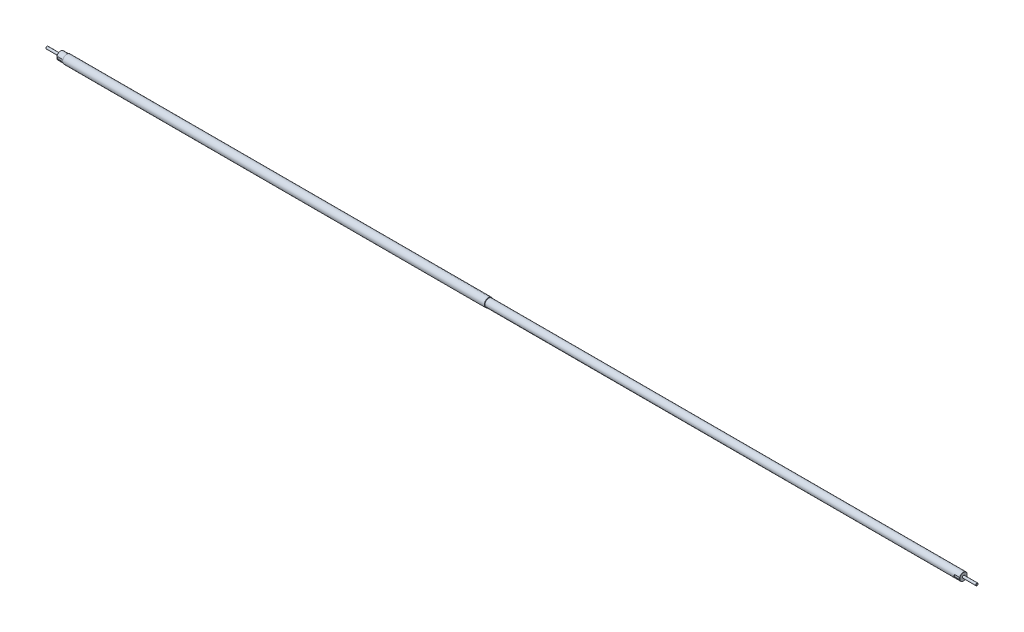
from build123d import *

# Parameters (mm, degrees)
CHAMFER_1_SIZE      = 0.5
CUT_EXTRUDE_1_DEPTH = 1.2
SKETCH_5_R          = 4
CUT_EXTRUDE_2_DEPTH = 5
CUT_EXTRUDE_3_DEPTH = 1.2


with BuildPart() as part:
    # Эскиз1 → Повернуть1 (revolve)
    with BuildSketch(Plane.XY):
        with BuildLine():
            Line((0, 2.5), (0, 0))
            Line((0, 0), (721.167070453, 0))
            Line((721.167070453, 0), (1185.852894625, 0))
            Line((1185.852894625, 0), (2359.852894625, 0))
            Line((2359.852894625, 0), (2410.852894625, 0))
            Line((2410.852894625, 0), (2410.852894625, 3))
            Line((2410.852894625, 3), (2375.852894625, 3))
            Line((2375.852894625, 3), (2375.852894625, 10))
            Line((2375.852894625, 10), (2359.852894625, 10))
            Line((2359.852894625, 10), (1206.852894625, 10))
            Line((1206.852894625, 10), (1185.852894625, 10))
            Line((1185.852894625, 10), (1145.2, 10))
            ThreePointArc((1145.2, 10), (1145.058578644, 10.058578644), (1145, 10.2))
            Line((1145, 10.2), (1145, 10.5))
            Line((1145, 10.5), (1144.5, 11))
            Line((1144.5, 11), (51.5, 11))
            Line((51.5, 11), (51, 10.5))
            Line((51, 10.5), (51, 10.2))
            ThreePointArc((51, 10.2), (50.941421356, 10.058578644), (50.8, 10))
            Line((50.8, 10), (35.5, 10))
            Line((35.5, 10), (35, 9.5))
            Line((35, 9.5), (35, 3.5))
            ThreePointArc((35, 3.5), (34.853553391, 3.146446609), (34.5, 3))
            Line((34.5, 3), (0.5, 3))
            Line((0.5, 3), (0, 2.5))
        make_face()
    revolve(axis=Axis((0, 0, 0), (1, 0, 0)))

    # Фаска1
    chamfer_1_edges = [part.edges().sort_by_distance(p)[0] for p in [
        (2375.852894625, -10, 0),
        (2410.852894625, -3, 0),
    ]]
    chamfer(chamfer_1_edges, length=CHAMFER_1_SIZE)

    # Эскиз3 → Вырез-Вытянуть1 (cut)
    with BuildSketch(Plane.XY.offset(10)):
        with BuildLine():
            Line((39, 3), (47, 3))
            ThreePointArc((47, 3), (50, 0), (47, -3))
            Line((47, -3), (39, -3))
            ThreePointArc((39, -3), (36, 0), (39, 3))
        make_face()
    extrude(amount=-CUT_EXTRUDE_1_DEPTH, mode=Mode.SUBTRACT)

    # Эскиз5 → Вырез-Вытянуть2 (cut)
    with BuildSketch(Plane(origin=(0, 0, -10), x_dir=(-1, 0, 0), z_dir=(0, 0, -1))):
        with Locations((-1155, 0)):
            Circle(SKETCH_5_R)
    extrude(amount=-CUT_EXTRUDE_2_DEPTH, mode=Mode.SUBTRACT)

    # Эскиз6 → Вырез-Вытянуть3 (cut)
    with BuildSketch(Plane.XY.offset(10)):
        with BuildLine():
            Line((2363.852894625, 3), (2371.852894625, 3))
            ThreePointArc((2371.852894625, 3), (2374.852894625, 0), (2371.852894625, -3))
            Line((2371.852894625, -3), (2363.852894625, -3))
            ThreePointArc((2363.852894625, -3), (2360.852894625, 0), (2363.852894625, 3))
        make_face()
    extrude(amount=-CUT_EXTRUDE_3_DEPTH, mode=Mode.SUBTRACT)


solid = part.part
